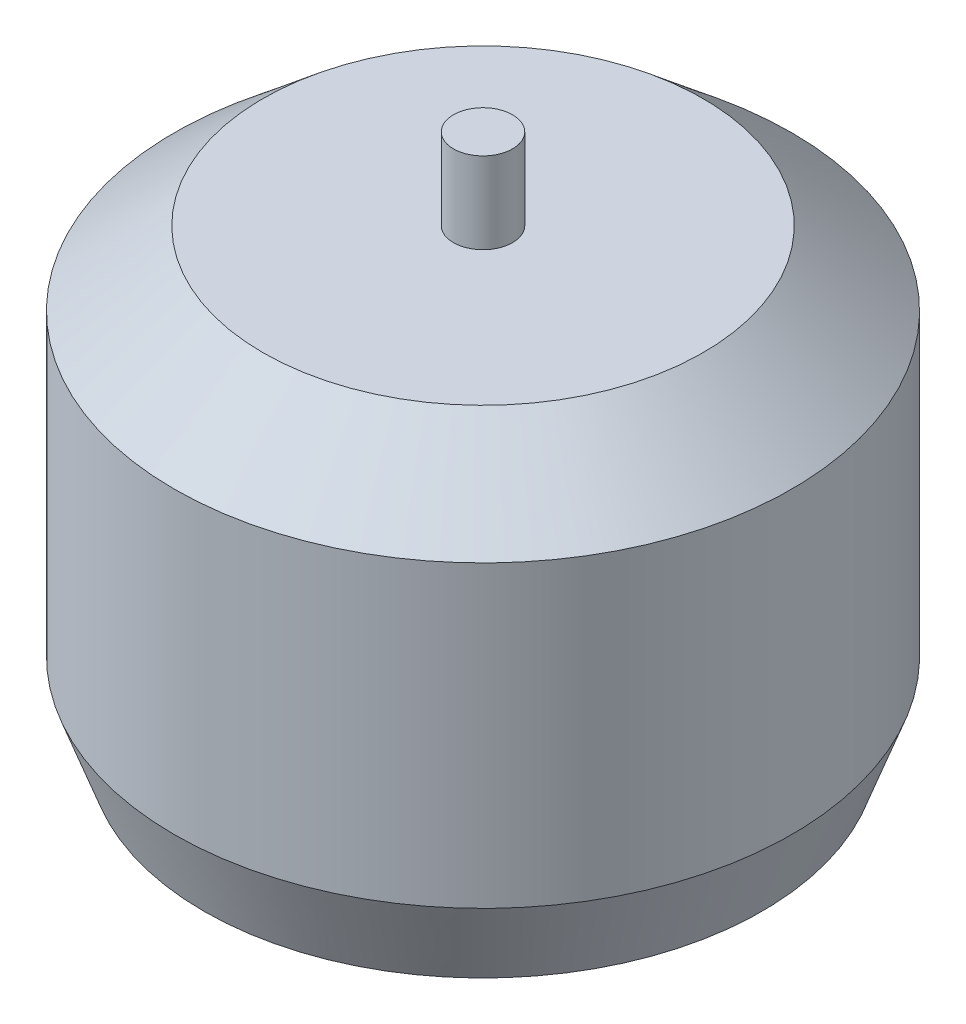
from build123d import *

# Parameters (mm, degrees)
SKETCH1_R           = 20.9
BOSS_EXTRUDE1_DEPTH = 30.75
CHAMFER1_SIZE       = 5
CHAMFER1_SIZE2      = 6
CHAMFER2_SIZE       = 2
CHAMFER2_SIZE2      = 5.494954839
SKETCH2_R           = 2
BOSS_EXTRUDE2_DEPTH = 5.5
SKETCH3_R           = 4
BOSS_EXTRUDE3_DEPTH = 2.55


with BuildPart() as part:
    # Sketch1 → Boss-Extrude1 (new body)
    with BuildSketch(Plane(origin=(0, 0, 0), x_dir=(1, 0, 0), z_dir=(0, 1, 0))):
        with Locations(Location((-5.649057894, -5.328088696, 0), (0, 0, 270))):
            Circle(SKETCH1_R)
    extrude(amount=BOSS_EXTRUDE1_DEPTH)

    # Chamfer1
    chamfer1_edges = [part.edges().sort_by_distance(p)[0] for p in [
        (-5.649057894, 30.75, -15.571911304),
    ]]
    chamfer1_side = [part.faces().sort_by_distance(p)[0] for p in [
        (-5.649057894, 15.375, -15.571911304),
    ]]
    chamfer(chamfer1_edges, length=CHAMFER1_SIZE, length2=CHAMFER1_SIZE2, reference=chamfer1_side[0])

    # Chamfer2
    chamfer2_edges = [part.edges().sort_by_distance(p)[0] for p in [
        (-5.649057894, 0, -15.571911304),
    ]]
    chamfer2_side = [part.faces().sort_by_distance(p)[0] for p in [
        (-5.649057894, 0, 5.328088696),
    ]]
    chamfer(chamfer2_edges, length=CHAMFER2_SIZE, length2=CHAMFER2_SIZE2, reference=chamfer2_side[0])

    # Sketch2 → Boss-Extrude2 (add)
    with BuildSketch(Plane(origin=(0, 30.75, 0), x_dir=(1, 0, 0), z_dir=(0, 1, 0))):
        with Locations(Location((-5.649057894, -5.328088696, 0), (0, 0, 270))):
            Circle(SKETCH2_R)
    extrude(amount=BOSS_EXTRUDE2_DEPTH)

    # Sketch3 → Boss-Extrude3 (add)
    with BuildSketch(Plane.XZ):
        with Locations(Location((-5.649057894, 5.328088696, 0), (0, 0, 90))):
            Circle(SKETCH3_R)
    extrude(amount=BOSS_EXTRUDE3_DEPTH)


solid = part.part
